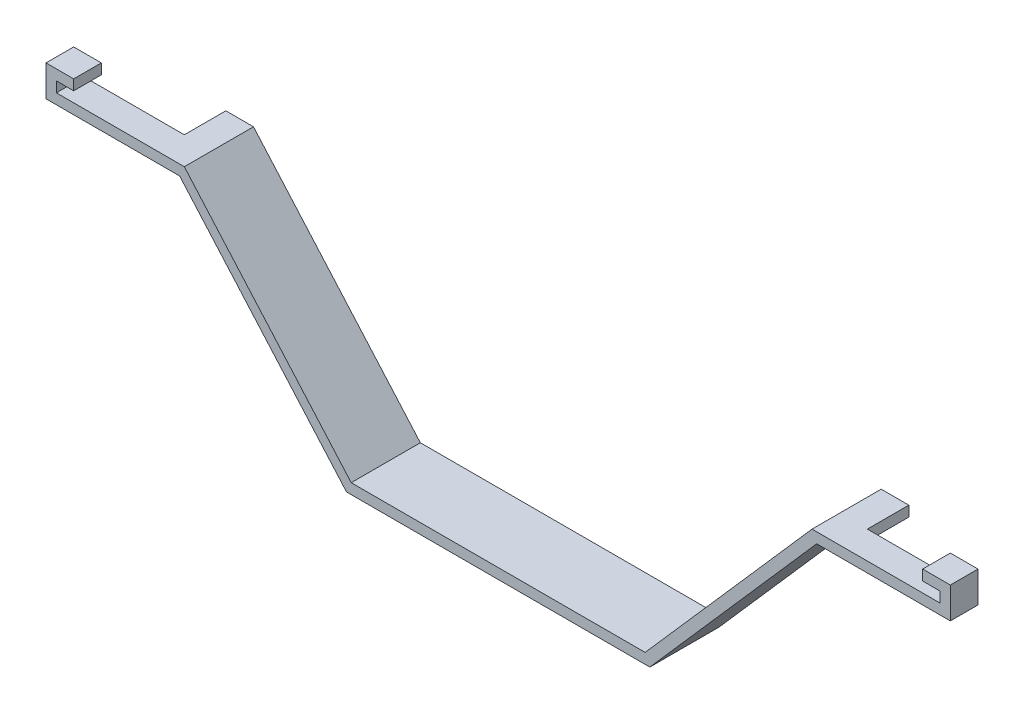
from build123d import *

# Parameters (mm, degrees)
BOSS_EXTRUDE1_DEPTH = 20
SKETCH2_W           = 32
SKETCH2_H           = 24
CUT_EXTRUDE1_DEPTH  = 190.205374127


with BuildPart() as part:
    # Sketch1 → Boss-Extrude1 (new body)
    with BuildSketch(Plane.XY):
        Polygon((-173.925616004, 29.588970737), (-136.925616004, 29.588970737), (-88.675616004, -25.411029263), (-3.675616004, -25.411029263), (44.574383996, 29.588970737), (81.574383996, 29.588970737), (81.574383996, 32.588970737), (76.574383996, 32.588970737), (76.574383996, 35.588970737), (84.574383996, 35.588970737), (84.574383996, 26.588970737), (45.933363597, 26.588970737), (-2.316636403, -28.411029263), (-90.034595605, -28.411029263), (-138.284595605, 26.588970737), (-176.925616004, 26.588970737), (-176.925616004, 35.588970737), (-168.925616004, 35.588970737), (-168.925616004, 32.588970737), (-173.925616004, 32.588970737), align=None)
    extrude(amount=BOSS_EXTRUDE1_DEPTH)

    # Sketch2 → Cut-Extrude1 (cut, through all)
    with BuildSketch(Plane(origin=(0, 35.588970737, 0), x_dir=(1, 0, 0), z_dir=(0, 1, 0))):
        with Locations((-160.925616004, 0)):
            Rectangle(SKETCH2_W, SKETCH2_H)
        with Locations((68.574383996, 0)):
            Rectangle(SKETCH2_W, SKETCH2_H)
    extrude(amount=-CUT_EXTRUDE1_DEPTH, mode=Mode.SUBTRACT)


solid = part.part
